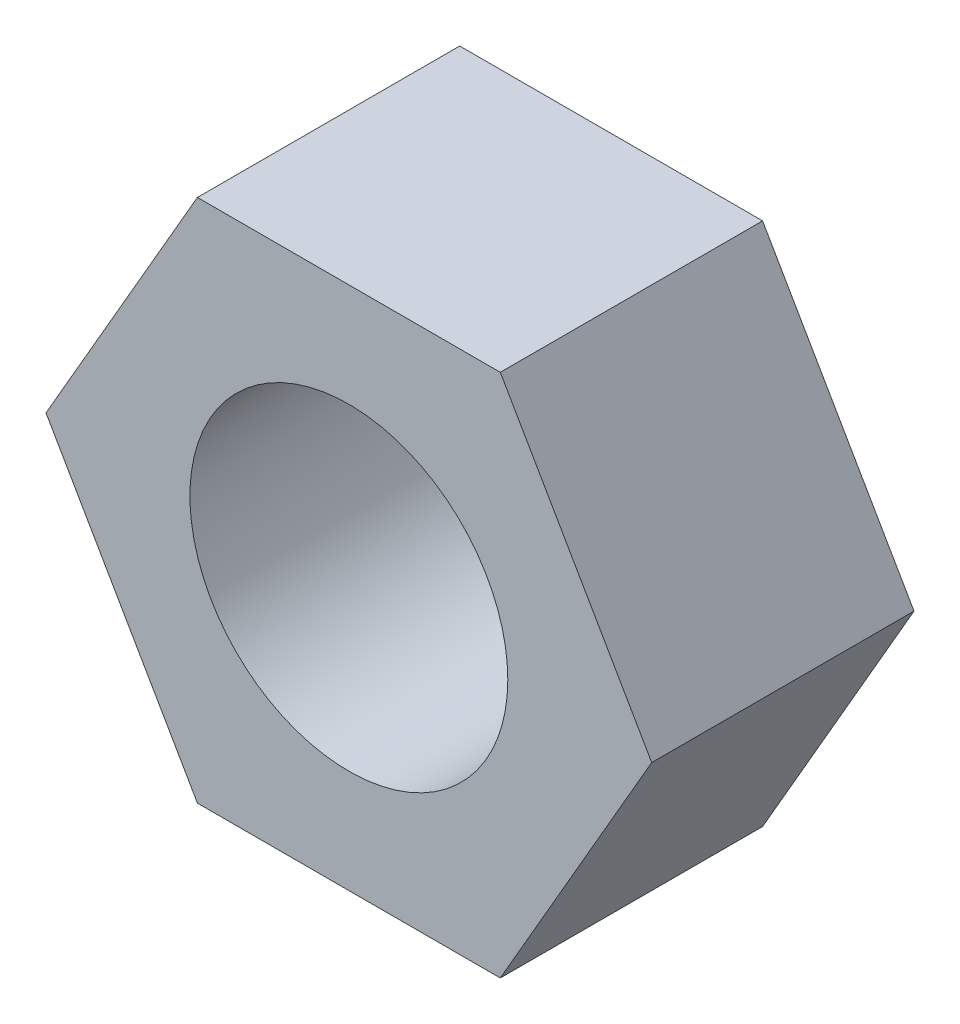
from build123d import *

# Parameters (mm, degrees)
S01_M6_HEX_NUT_AF10_R      = 3.03
F_01_M6_HEX_NUT_AF10_DEPTH = 5


with BuildPart() as part:
    # S01 - M6 hex nut AF10 → 01 - M6 hex nut AF10 (new body)
    with BuildSketch(Plane.XY):
        Polygon((5.773502692, 0), (2.886751346, 5), (-2.886751346, 5), (-5.773502692, 0), (-2.886751346, -5), (2.886751346, -5), align=None)
        Circle(S01_M6_HEX_NUT_AF10_R, mode=Mode.SUBTRACT)
    extrude(amount=F_01_M6_HEX_NUT_AF10_DEPTH)


solid = part.part
